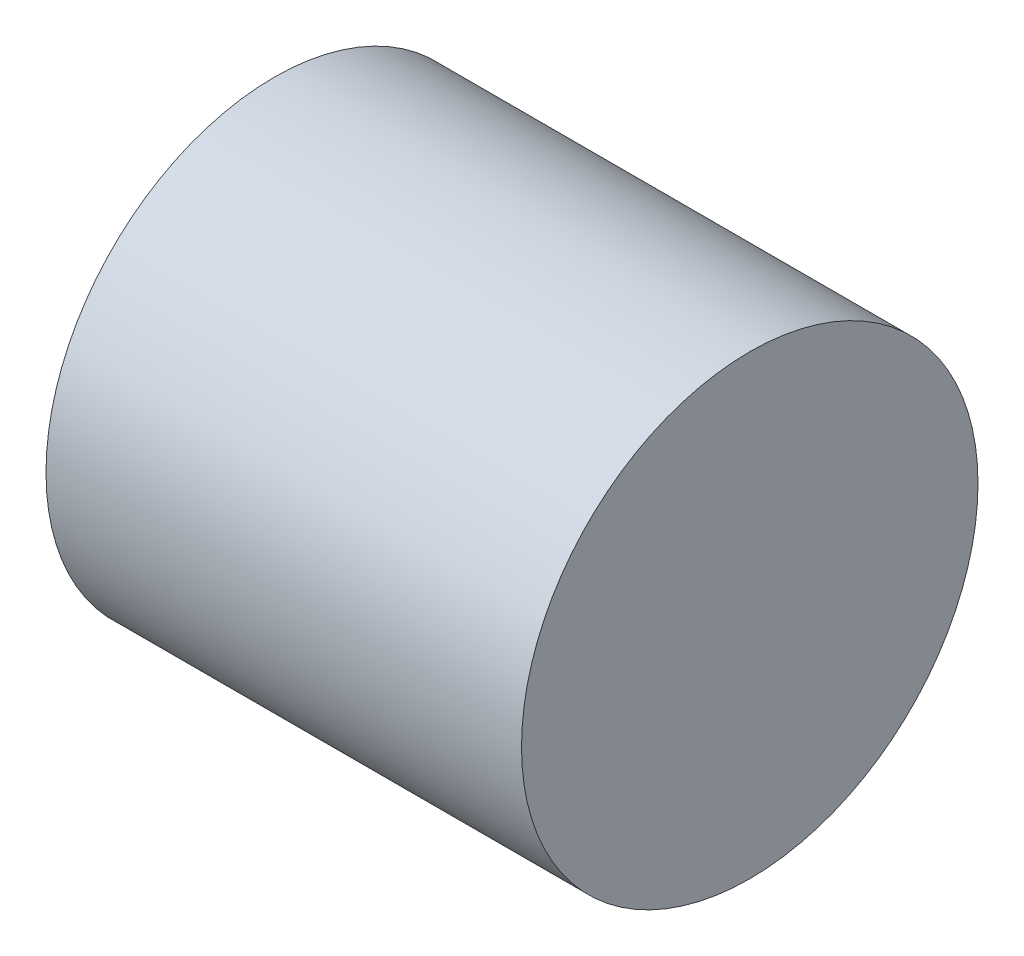
from build123d import *

# Parameters (mm, degrees)
SKETCH1_W      = 25
SKETCH1_H      = 12
REVOLVE1_ANGLE = 359.999999589


with BuildPart() as part:
    # Sketch1 → Revolve1 (revolve)
    with BuildSketch(Plane.XY):
        with Locations((12.5, 6)):
            Rectangle(SKETCH1_W, SKETCH1_H)
    revolve(axis=Axis((0, 0, 0), (1, 0, 0)), revolution_arc=REVOLVE1_ANGLE)


solid = part.part
